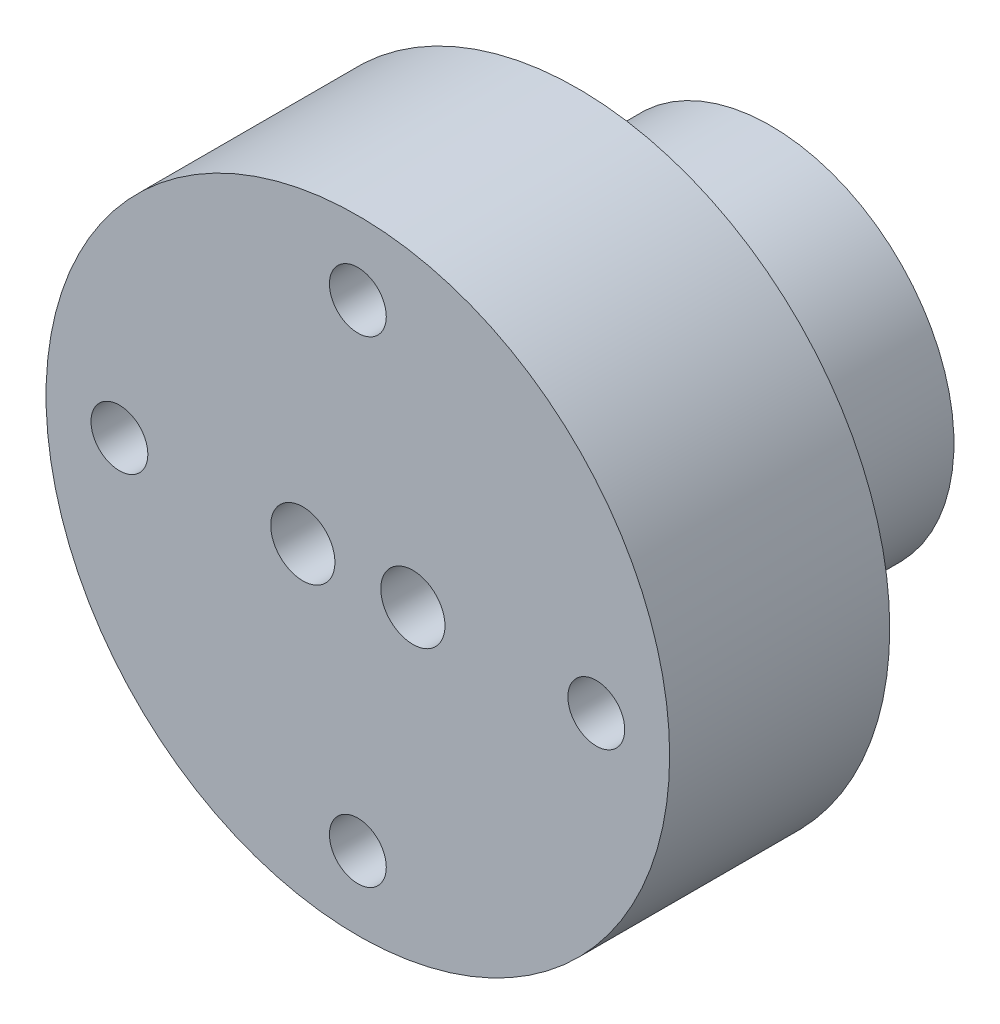
from build123d import *

# Parameters (mm, degrees)
SKETCH1_R           = 10
BOSS_EXTRUDE1_DEPTH = 10.5
SKETCH3_R           = 17
BOSS_EXTRUDE2_DEPTH = 12
SKETCH4_R           = 1.55
CUT_EXTRUDE3_DEPTH  = 33.927951652
SKETCH5_R           = 1.55
CUT_EXTRUDE5_DEPTH  = 33.927951652
SKETCH6_R           = 1.75
CUT_EXTRUDE6_DEPTH  = 5.2
SKETCH7_R           = 1.75
CUT_EXTRUDE7_DEPTH  = 5.2


with BuildPart() as part:
    # Sketch1 → Boss-Extrude1 (new body)
    with BuildSketch(Plane.XY):
        with Locations(Location((0, 0, 0), (0, 0, 180))):
            Circle(SKETCH1_R)
    extrude(amount=BOSS_EXTRUDE1_DEPTH)

    # Sketch3 → Boss-Extrude2 (add)
    with BuildSketch(Plane.XY.offset(10.5)):
        Circle(SKETCH3_R)
    extrude(amount=BOSS_EXTRUDE2_DEPTH)

    # Sketch4 → Cut-Extrude3 (cut, through all)
    with BuildSketch(Plane.XY.offset(22.5)):
        with Locations((3, 0)):
            Circle(SKETCH4_R)
        with Locations((-3, 0)):
            Circle(SKETCH4_R)
    extrude(amount=-CUT_EXTRUDE3_DEPTH, mode=Mode.SUBTRACT)

    # Sketch5 → Cut-Extrude5 (cut, through all)
    with BuildSketch(Plane.XY.offset(22.5)):
        with Locations((13, 0)):
            Circle(SKETCH5_R)
        with Locations((0, -13)):
            Circle(SKETCH5_R)
        with Locations((-13, 0)):
            Circle(SKETCH5_R)
        with Locations((0, 13)):
            Circle(SKETCH5_R)
    extrude(amount=-CUT_EXTRUDE5_DEPTH, mode=Mode.SUBTRACT)

    # Sketch6 → Cut-Extrude6 (cut)
    with BuildSketch(Plane(origin=(0, 0, 10.5), x_dir=(-1, 0, 0), z_dir=(0, 0, -1))):
        with Locations((13, 0)):
            Circle(SKETCH6_R)
        with Locations((0, -13)):
            Circle(SKETCH6_R)
        with Locations((-13, 0)):
            Circle(SKETCH6_R)
        with Locations((0, 13)):
            Circle(SKETCH6_R)
    extrude(amount=-CUT_EXTRUDE6_DEPTH, mode=Mode.SUBTRACT)

    # Sketch7 → Cut-Extrude7 (cut)
    with BuildSketch(Plane.XY.offset(22.5)):
        with Locations((3, 0)):
            Circle(SKETCH7_R)
        with Locations((-3, 0)):
            Circle(SKETCH7_R)
    extrude(amount=-CUT_EXTRUDE7_DEPTH, mode=Mode.SUBTRACT)


solid = part.part
